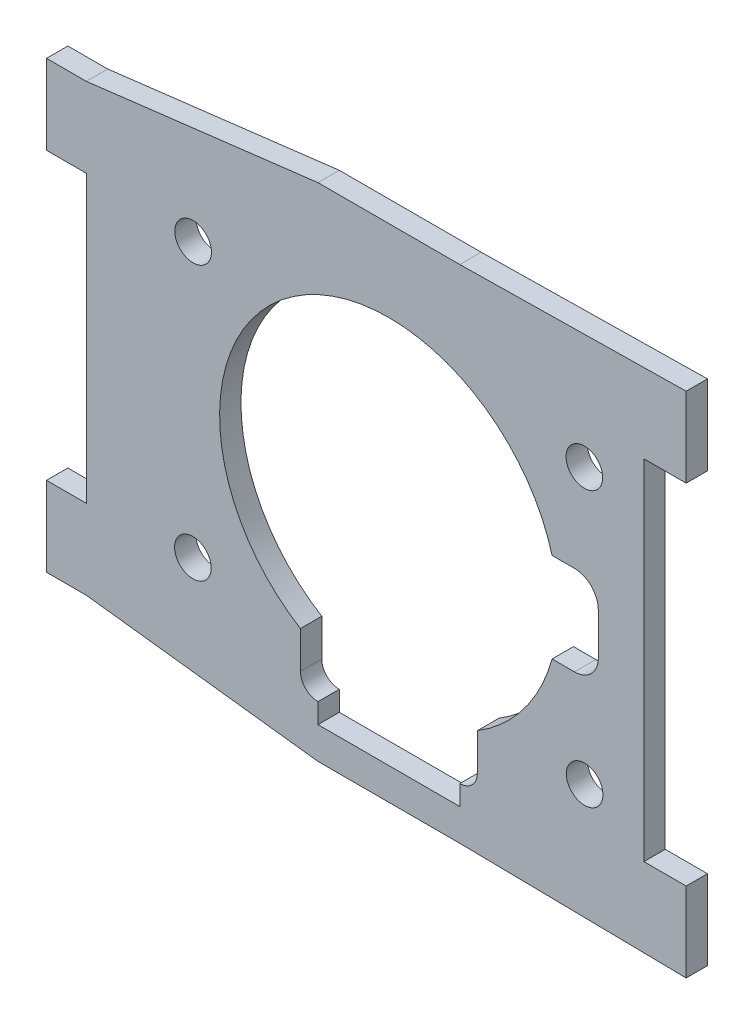
from build123d import *

# Parameters (mm, degrees)
SKETCH1_R           = 2.921000021
BOSS_EXTRUDE1_DEPTH = 3.4036


with BuildPart() as part:
    # Sketch1 → Boss-Extrude1 (new body)
    with BuildSketch(Plane.XY):
        Polygon((6298.761762124, 3495.306881262), (6321.380962278, 3495.307266858), (6357.4701776, 3494.754624258), (6357.4701776, 3507.454624258), (6350.731610594, 3507.454624258), (6350.731610594, 3563.080624258), (6357.4701776, 3563.080624258), (6357.4701776, 3575.780624258), (6321.380962278, 3575.227981658), (6298.761762124, 3575.228367254), (6261.831610594, 3570.751424258), (6255.481610594, 3570.751424258), (6255.481610594, 3558.051424258), (6261.831610594, 3558.051424258), (6261.831610594, 3512.483824258), (6255.481610594, 3512.483824258), (6255.481610594, 3499.783824258), (6261.831610594, 3499.783824258), align=None)
        with Locations((6278.820230754, 3513.47268496)):
            Circle(SKETCH1_R, mode=Mode.SUBTRACT)
        with Locations((6341.280374087, 3513.414361889)):
            Circle(SKETCH1_R, mode=Mode.SUBTRACT)
        with Locations((6341.23876101, 3557.180196157)):
            Circle(SKETCH1_R, mode=Mode.SUBTRACT)
        with Locations((6278.860987901, 3557.120886627)):
            Circle(SKETCH1_R, mode=Mode.SUBTRACT)
        with BuildLine():
            Line((6343.460429176, 3531.918193441), (6343.460314953, 3538.618193502))
            ThreePointArc((6343.460314953, 3538.618193502), (6342.349105565, 3541.300760923), (6339.666500257, 3542.411878844))
            Line((6339.666500257, 3542.411878844), (6336.09539352, 3542.411817963))
            ThreePointArc((6336.09539352, 3542.411817963), (6293.858290099, 3556.842691981), (6295.967723135, 3512.258240403))
            Line((6295.967723135, 3512.258240403), (6295.96782376, 3506.355583647))
            ThreePointArc((6295.96782376, 3506.355583647), (6296.78612787, 3504.380118018), (6298.761621398, 3503.561881261))
            Line((6298.761621398, 3503.561881261), (6298.761675524, 3500.386881261))
            Line((6298.761675524, 3500.386881261), (6321.380875678, 3500.387266857))
            Line((6321.380875678, 3500.387266857), (6321.380821552, 3503.562266857))
            ThreePointArc((6321.380821552, 3503.562266857), (6323.356287182, 3504.380570967), (6324.174523939, 3506.356064496))
            Line((6324.174523939, 3506.356064496), (6324.174423315, 3512.258721235))
            ThreePointArc((6324.174423315, 3512.258721235), (6331.646301452, 3519.055968956), (6336.095637085, 3528.124317864))
            Line((6336.095637085, 3528.124317864), (6339.666743834, 3528.124378745))
            ThreePointArc((6339.666743834, 3528.124378745), (6342.349311255, 3529.235588133), (6343.460429176, 3531.918193441))
        make_face(mode=Mode.SUBTRACT)
    extrude(amount=BOSS_EXTRUDE1_DEPTH)


solid = part.part
